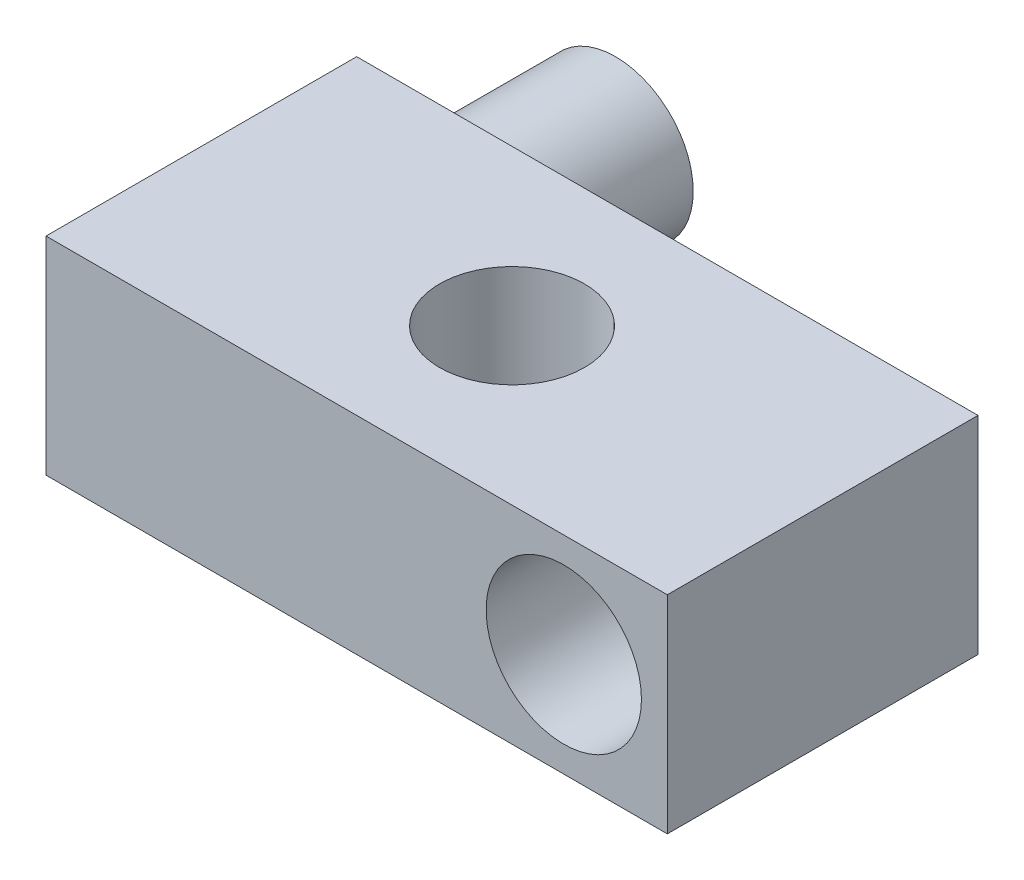
from build123d import *

# Parameters (mm, degrees)
SKETCH_1_W          = 12
SKETCH_1_H          = 4
SKETCH_1_R          = 1.5
EXTRUDE_1_DEPTH     = 6
SKETCH_2_R          = 1.5
EXTRUDE_2_DEPTH     = 3
CUT_EXTRUDE_1_REACH = 15.118
SKETCH_3_R          = 1.4


with BuildPart() as part:
    # Эскиз1 → Бобышка-Вытянуть1 (new body)
    with BuildSketch(Plane.XY):
        with Locations((4.958157727, 0.498048464)):
            Rectangle(SKETCH_1_W, SKETCH_1_H)
        with Locations((8.958157727, 0.498048464)):
            Circle(SKETCH_1_R, mode=Mode.SUBTRACT)
    extrude(amount=EXTRUDE_1_DEPTH)

    # Эскиз2 → Бобышка-Вытянуть2 (add)
    with BuildSketch(Plane(origin=(0, 0, 0), x_dir=(-1, 0, 0), z_dir=(0, 0, -1))):
        with Locations(Location((-0.958157727, 0.498048464, 0), (0, 0, 180))):
            Circle(SKETCH_2_R)
    extrude(amount=EXTRUDE_2_DEPTH)

    # Эскиз3 → Вырез-Вытянуть1 (cut, up to next)
    with BuildSketch(Plane.XZ.offset(1.501951536), mode=Mode.PRIVATE) as cut_extrude_1_sk1:
        with Locations((4.958157727, 3)):
            Circle(SKETCH_3_R)
    cut_extrude_1_tool1 = extrude(cut_extrude_1_sk1.sketch, amount=-CUT_EXTRUDE_1_REACH, mode=Mode.PRIVATE) & part.part
    add(cut_extrude_1_tool1.solids().sort_by_distance((4.958158, -1.501952, 3))[0], mode=Mode.SUBTRACT)


solid = part.part
